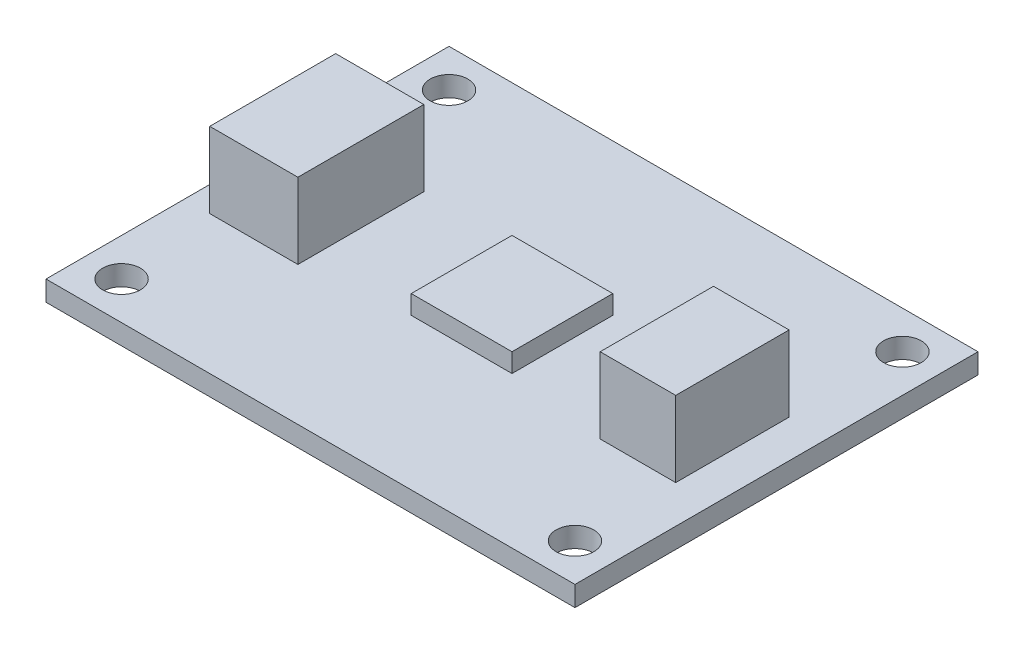
from build123d import *

# Parameters (mm, degrees)
SKETCH1_W                 = 42
SKETCH1_H                 = 32
PCB_DEPTH                 = 1.6
MOUNT_HOLE_1_DEPTH        = 53.825751296
MOUNT_HOLE_1_DEPTH_BACK   = 53.825751296
SKETCH2_R                 = 1.5
MOUNT_HOLE_2_DEPTH        = 53.825751296
MOUNT_HOLE_2_DEPTH_BACK   = 53.825751296
SKETCH3_R                 = 1.5
MOUNT_HOLE_3_DEPTH        = 53.825751296
MOUNT_HOLE_3_DEPTH_BACK   = 53.825751296
SKETCH4_R                 = 1.5
MOUNT_HOLE_4_DEPTH        = 53.825751296
MOUNT_HOLE_4_DEPTH_BACK   = 53.825751296
SKETCH5_R                 = 1.5
PROBE_CONNECTOR_XH_START  = 1.6
SKETCH6_W                 = 7
SKETCH6_H                 = 10
PROBE_CONNECTOR_XH_DEPTH  = 6
SIGNAL_CONNECTOR_PH_START = 1.6
SKETCH7_W                 = 6
SKETCH7_H                 = 9
SIGNAL_CONNECTOR_PH_DEPTH = 6
SIGNAL_IC_START           = 1.6
SKETCH8_W                 = 8
SKETCH8_H                 = 8
SIGNAL_IC_DEPTH           = 1.5


with BuildPart() as part:
    # Sketch1 → PCB (new body)
    with BuildSketch(Plane(origin=(0, 0, 0), x_dir=(1, 0, 0), z_dir=(0, 1, 0))):
        with Locations((21, 16)):
            Rectangle(SKETCH1_W, SKETCH1_H)
    extrude(amount=PCB_DEPTH)

    # Sketch2 → Mount_hole_1 (cut, two sides: drawn at the far end of the back side and taken through both)
    with BuildSketch(Plane(origin=(0, 0, 0), x_dir=(1, 0, 0), z_dir=(0, 1, 0)).offset(-MOUNT_HOLE_1_DEPTH_BACK)):
        with Locations(Location((3, 3, 0), (0, 0, 270))):
            Circle(SKETCH2_R)
    extrude(amount=MOUNT_HOLE_1_DEPTH + MOUNT_HOLE_1_DEPTH_BACK, mode=Mode.SUBTRACT)

    # Sketch3 → Mount_hole_2 (cut, two sides: drawn at the far end of the back side and taken through both)
    with BuildSketch(Plane(origin=(0, 0, 0), x_dir=(1, 0, 0), z_dir=(0, 1, 0)).offset(-MOUNT_HOLE_2_DEPTH_BACK)):
        with Locations(Location((39, 3, 0), (0, 0, 270))):
            Circle(SKETCH3_R)
    extrude(amount=MOUNT_HOLE_2_DEPTH + MOUNT_HOLE_2_DEPTH_BACK, mode=Mode.SUBTRACT)

    # Sketch4 → Mount_hole_3 (cut, two sides: drawn at the far end of the back side and taken through both)
    with BuildSketch(Plane(origin=(0, 0, 0), x_dir=(1, 0, 0), z_dir=(0, 1, 0)).offset(-MOUNT_HOLE_3_DEPTH_BACK)):
        with Locations(Location((3, 29, 0), (0, 0, 270))):
            Circle(SKETCH4_R)
    extrude(amount=MOUNT_HOLE_3_DEPTH + MOUNT_HOLE_3_DEPTH_BACK, mode=Mode.SUBTRACT)

    # Sketch5 → Mount_hole_4 (cut, two sides: drawn at the far end of the back side and taken through both)
    with BuildSketch(Plane(origin=(0, 0, 0), x_dir=(1, 0, 0), z_dir=(0, 1, 0)).offset(-MOUNT_HOLE_4_DEPTH_BACK)):
        with Locations(Location((39, 29, 0), (0, 0, 270))):
            Circle(SKETCH5_R)
    extrude(amount=MOUNT_HOLE_4_DEPTH + MOUNT_HOLE_4_DEPTH_BACK, mode=Mode.SUBTRACT)

    # Sketch6 → Probe_connector_XH (add)
    with BuildSketch(Plane(origin=(0, 0, 0), x_dir=(1, 0, 0), z_dir=(0, 1, 0)).offset(PROBE_CONNECTOR_XH_START)):
        with Locations((5.5, 16)):
            Rectangle(SKETCH6_W, SKETCH6_H)
    extrude(amount=PROBE_CONNECTOR_XH_DEPTH)

    # Sketch7 → Signal_connector_PH (add)
    with BuildSketch(Plane(origin=(0, 0, 0), x_dir=(1, 0, 0), z_dir=(0, 1, 0)).offset(SIGNAL_CONNECTOR_PH_START)):
        with Locations((36, 15.5)):
            Rectangle(SKETCH7_W, SKETCH7_H)
    extrude(amount=SIGNAL_CONNECTOR_PH_DEPTH)

    # Sketch8 → Signal_IC (add)
    with BuildSketch(Plane(origin=(0, 0, 0), x_dir=(1, 0, 0), z_dir=(0, 1, 0)).offset(SIGNAL_IC_START)):
        with Locations((21, 16)):
            Rectangle(SKETCH8_W, SKETCH8_H)
    extrude(amount=SIGNAL_IC_DEPTH)


solid = part.part
